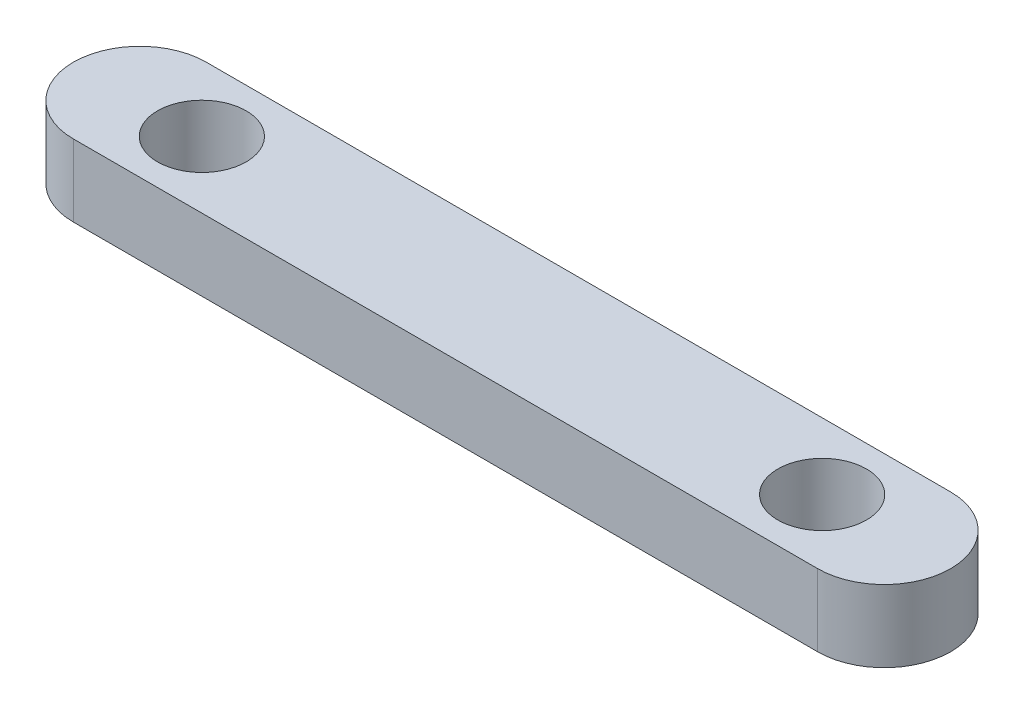
from build123d import *

# Parameters (mm, degrees)
SKETCH1_R           = 1.2499975
BOSS_EXTRUDE1_DEPTH = 2.032


with BuildPart() as part:
    # Sketch1 → Boss-Extrude1 (new body)
    with BuildSketch(Plane(origin=(0, 0, 0), x_dir=(1, 0, 0), z_dir=(0, 1, 0))):
        with BuildLine():
            Line((0, 1.8750026), (21.0000088, 1.8750026))
            ThreePointArc((21.0000088, 1.8750026), (22.8750114, 0), (21.0000088, -1.8750026))
            Line((21.0000088, -1.8750026), (0, -1.8750026))
            ThreePointArc((0, -1.8750026), (-1.8750026, 0), (0, 1.8750026))
        make_face()
        with Locations(Location((1.7500092, 0, 0), (0, 0, 270))):
            Circle(SKETCH1_R, mode=Mode.SUBTRACT)
        with Locations(Location((19.2499996, 0, 0), (0, 0, 90))):
            Circle(SKETCH1_R, mode=Mode.SUBTRACT)
    extrude(amount=BOSS_EXTRUDE1_DEPTH)


solid = part.part
